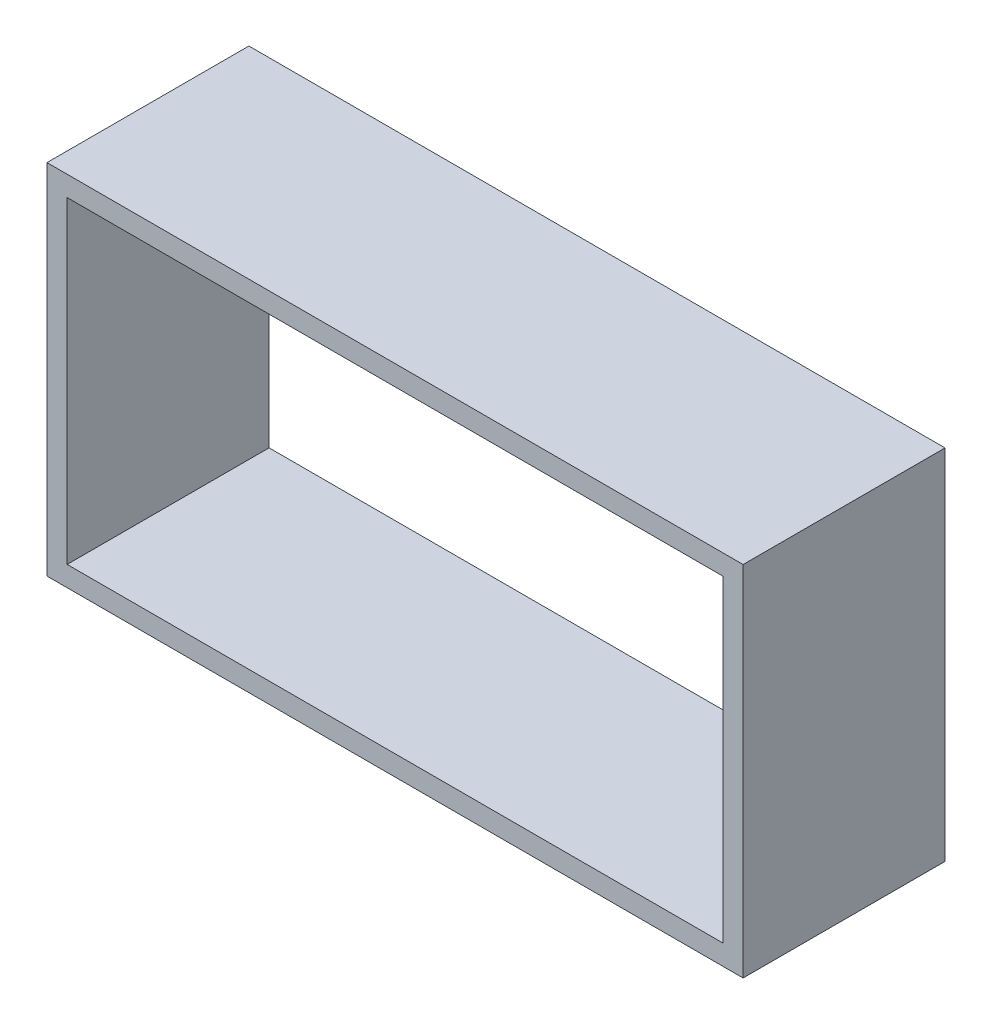
from build123d import *

# Parameters (mm, degrees)
SKETCH1_W           = 87.563531585
SKETCH1_H           = 45.042611083
BOSS_EXTRUDE1_DEPTH = 25.4
SKETCH2_W           = 82.483531585
SKETCH2_H           = 39.962611083
CUT_EXTRUDE1_DEPTH  = 102.692521243


with BuildPart() as part:
    # Sketch1 → Boss-Extrude1 (new body)
    with BuildSketch(Plane.XY):
        with Locations((43.781765793, 22.521305542)):
            Rectangle(SKETCH1_W, SKETCH1_H)
    extrude(amount=BOSS_EXTRUDE1_DEPTH)

    # Sketch2 → Cut-Extrude1 (cut, through all)
    with BuildSketch(Plane.XY.offset(25.4)):
        with Locations((43.781765793, 22.521305542)):
            Rectangle(SKETCH2_W, SKETCH2_H)
    extrude(amount=-CUT_EXTRUDE1_DEPTH, mode=Mode.SUBTRACT)


solid = part.part
